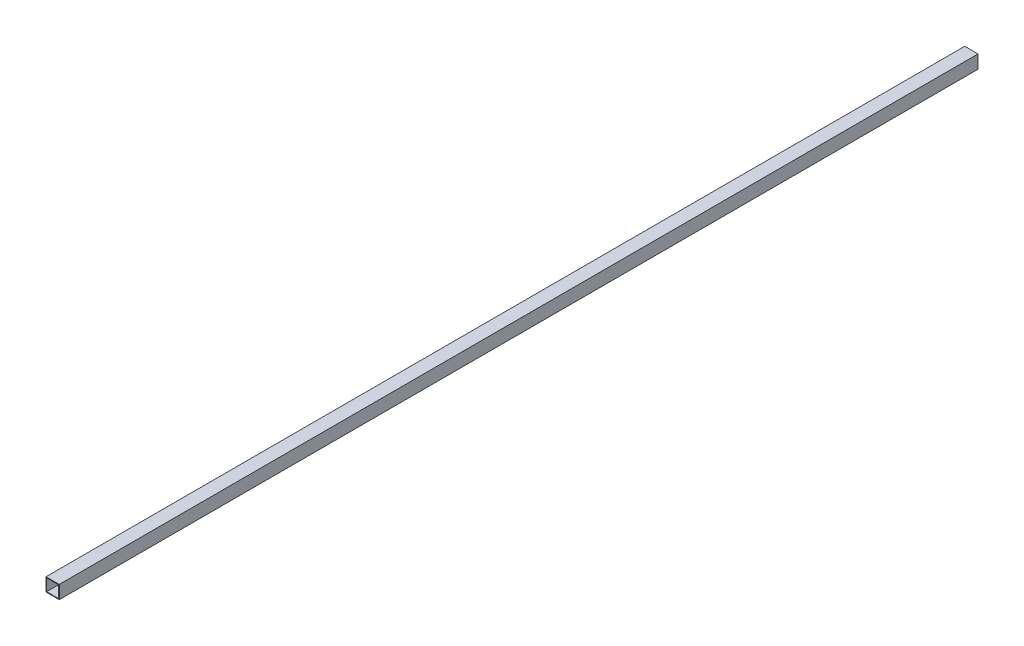
from build123d import *

# Parameters (mm, degrees)
SKETCH1_W           = 31.75
SKETCH1_H           = 31.75
SKETCH1_W_2         = 28.575
SKETCH1_H_2         = 28.575
BOSS_EXTRUDE1_DEPTH = 2200


with BuildPart() as part:
    # Sketch1 → Boss-Extrude1 (new body)
    with BuildSketch(Plane.XY):
        Rectangle(SKETCH1_W, SKETCH1_H)
        Rectangle(SKETCH1_W_2, SKETCH1_H_2, mode=Mode.SUBTRACT)
    extrude(amount=BOSS_EXTRUDE1_DEPTH)


solid = part.part
